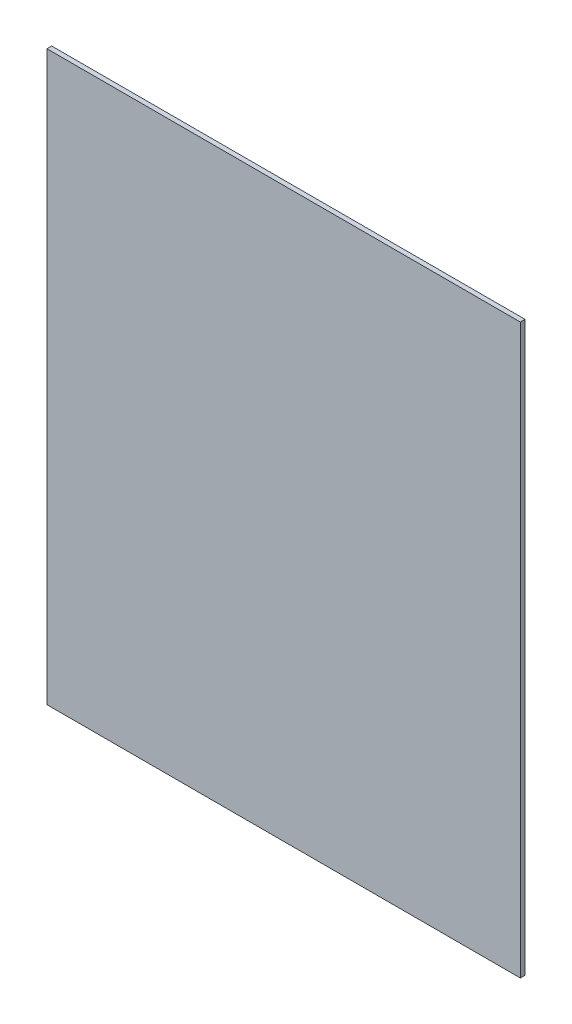
from build123d import *

# Parameters (mm, degrees)
SKETCH2_W           = 100
SKETCH2_H           = 120
BOSS_EXTRUDE1_DEPTH = 1


with BuildPart() as part:
    # Sketch2 → Boss-Extrude1 (new body)
    with BuildSketch(Plane.XY):
        Rectangle(SKETCH2_W, SKETCH2_H)
    extrude(amount=BOSS_EXTRUDE1_DEPTH)


solid = part.part
